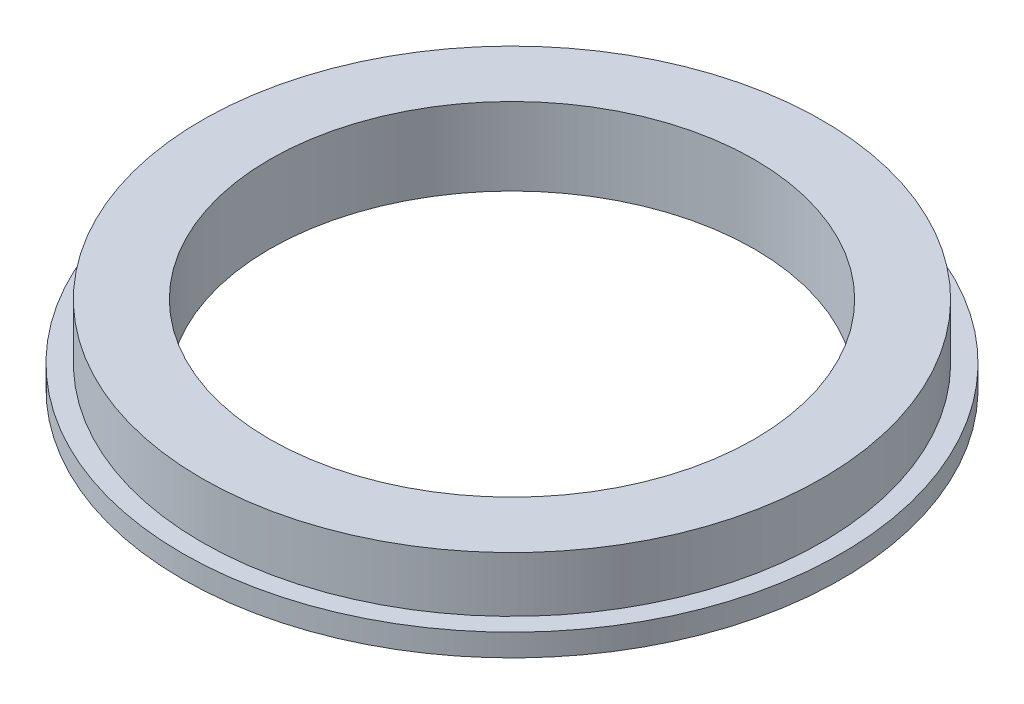
from build123d import *
from build123d.topology import SkipClean

# Parameters (mm, degrees)
SKETCH_1_R      = 16
SKETCH_1_R_2    = 12.5
EXTRUDE_1_DEPTH = 2.85
EXTRUDE_START   = 1.15
SKETCH_2_R      = 17
SKETCH_2_R_2    = 12.5
EXTRUDE_2_DEPTH = 1.15


with BuildPart() as part:
    # 草图1 → 凸台-拉伸1 (new body)
    with BuildSketch(Plane(origin=(0, 0, 0), x_dir=(1, 0, 0), z_dir=(0, 1, 0))):
        with Locations(Location((0, 0, 0), (0, 0, 270))):
            Circle(SKETCH_1_R)
        with Locations(Location((0, 0, 0), (0, 0, 270))):
            Circle(SKETCH_1_R_2, mode=Mode.SUBTRACT)
    extrude(amount=EXTRUDE_1_DEPTH)

    # 草图2 → 凸台-拉伸2 (add)
    with SkipClean():  # the faces are left unmerged after this step: merging them gives an invalid solid
        with BuildSketch(Plane.XZ.offset(EXTRUDE_START)):
            with Locations(Location((0, 0, 0), (0, 0, 270))):
                Circle(SKETCH_2_R)
            with Locations(Location((0, 0, 0), (0, 0, 270))):
                Circle(SKETCH_2_R_2, mode=Mode.SUBTRACT)
        extrude(amount=-EXTRUDE_2_DEPTH)


solid = part.part
